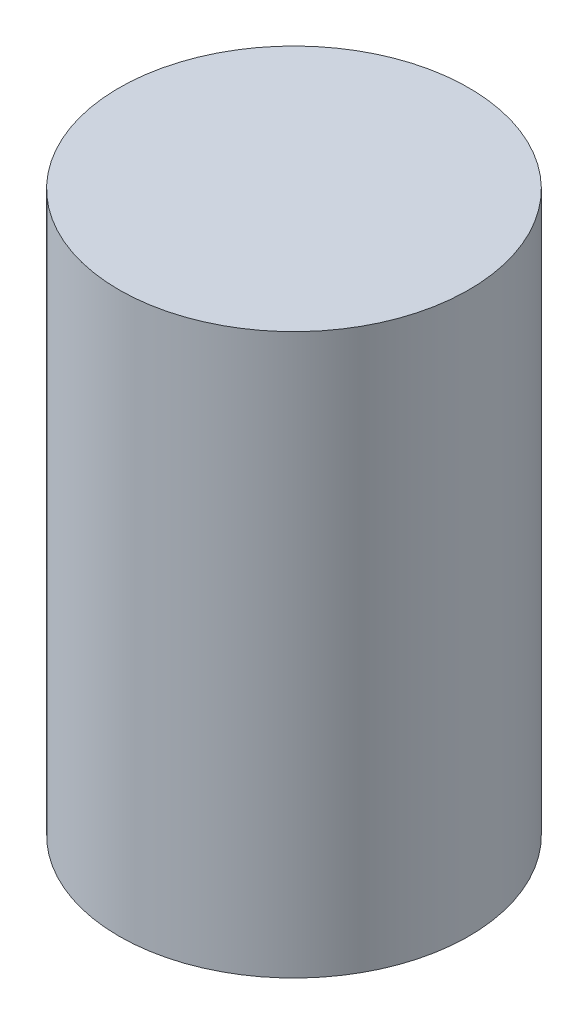
from build123d import *

# Parameters (mm, degrees)
SKETCH_1_R          = 25
EXTRUDE_1_DEPTH     = 80
SKETCH_3_R          = 22
CUT_EXTRUDE_1_DEPTH = 75
SKETCH_4_R          = 22
SKETCH_4_R_2        = 5
EXTRUDE_2_DEPTH     = 5


with BuildPart() as part:
    # 草图1 → 凸台-拉伸1 (new body)
    with BuildSketch(Plane(origin=(0, 0, 0), x_dir=(1, 0, 0), z_dir=(0, 1, 0))):
        with Locations(Location((0, 0, 0), (0, 0, 270))):
            Circle(SKETCH_1_R)
    extrude(amount=EXTRUDE_1_DEPTH)

    # 草图3 → 切除-拉伸1 (cut)
    with BuildSketch(Plane.XZ):
        with Locations(Location((0, 0, 0), (0, 0, 270))):
            Circle(SKETCH_3_R)
    extrude(amount=-CUT_EXTRUDE_1_DEPTH, mode=Mode.SUBTRACT)

    # 草图4 → 凸台-拉伸2 (add)
    with BuildSketch(Plane.XZ):
        with Locations(Location((0, 0, 0), (0, 0, 270))):
            Circle(SKETCH_4_R)
        with Locations(Location((0, 0, 0), (0, 0, 270))):
            Circle(SKETCH_4_R_2, mode=Mode.SUBTRACT)
    extrude(amount=-EXTRUDE_2_DEPTH)


solid = part.part
